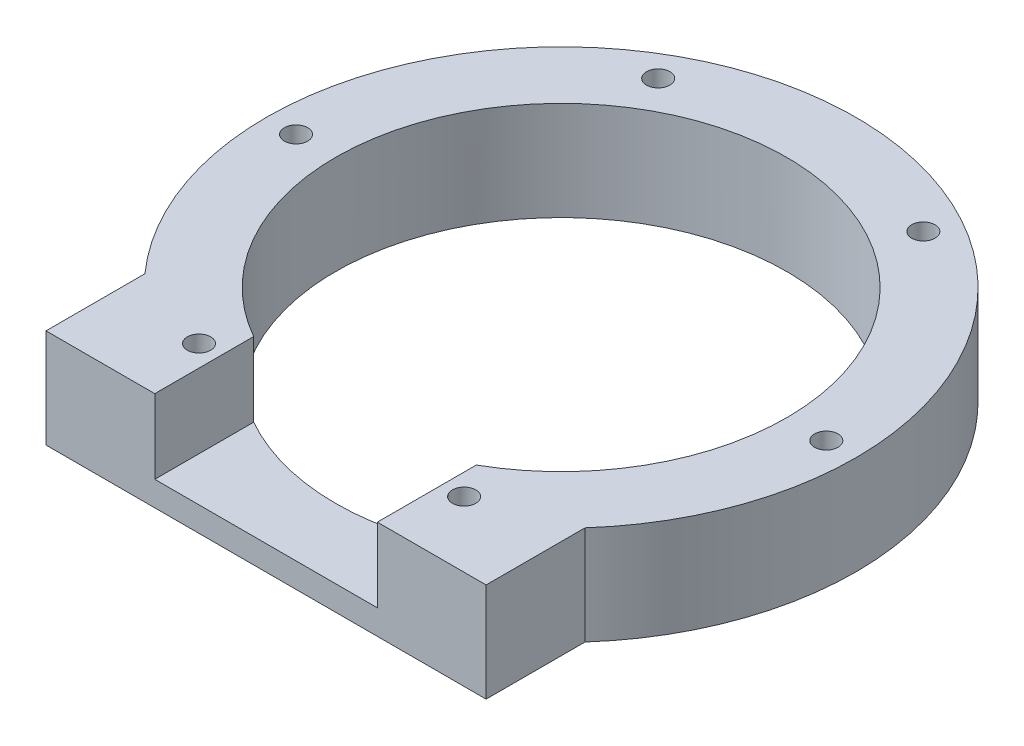
from build123d import *
from build123d.topology import SkipClean

# Parameters (mm, degrees)
BOSS_EXTRUDE1_DEPTH   = 12.7
SKETCH5_W             = 13.961436905
SKETCH5_H             = 12.7
BOSS_EXTRUDE3_DEPTH   = 12.7
F_3_0MM_DOWEL_HOLE1_D = 3
BOSS_EXTRUDE4_DEPTH   = 3.175


with BuildPart() as part:
    # Sketch1 → Boss-Extrude1 (new body)
    with BuildSketch(Plane(origin=(0, 0, 0), x_dir=(1, 0, 0), z_dir=(0, 1, 0))):
        with BuildLine():
            ThreePointArc((28.956, 0), (25.021578547, -14.572938722), (14.2875, -25.18565623))
            Line((14.2875, -25.18565623), (28.248936905, -25.18565623))
            ThreePointArc((28.248936905, -25.18565623), (35.365442045, -13.476098284), (37.846, 0))
            ThreePointArc((37.846, 0), (-13.476098284, 35.365442045), (-28.248936905, -25.18565623))
            Line((-28.248936905, -25.18565623), (-14.2875, -25.18565623))
            ThreePointArc((-14.2875, -25.18565623), (-14.572938722, 25.021578547), (28.956, 0))
        make_face()
    extrude(amount=BOSS_EXTRUDE1_DEPTH)

    # Sketch5 → Boss-Extrude3 (add)
    with BuildSketch(Plane.XY.offset(25.18565623)):
        with Locations((-21.268218453, 6.35)):
            Rectangle(SKETCH5_W, SKETCH5_H)
        with Locations((21.268218453, 6.35)):
            Rectangle(SKETCH5_W, SKETCH5_H)
    extrude(amount=BOSS_EXTRUDE3_DEPTH)

    # Ø3.0mm Dowel Hole1 (through all)
    with Locations(Plane(origin=(0, 0, 0), x_dir=(-1, 0, 0), z_dir=(0, -1, 0))):
        with Locations((-17.018, 29.476040643), (-34.036, 0), (17.018, 29.476040643), (34.036, 0), (17.018, -29.476040643), (-17.018, -29.476040643)):
            Hole(F_3_0MM_DOWEL_HOLE1_D / 2)

    # Sketch11 → Boss-Extrude4 (add)
    with SkipClean():  # the faces are left unmerged after this step: merging them gives an invalid solid
        with BuildSketch(Plane.XZ):
            with BuildLine():
                ThreePointArc((-14.2875, 25.18565623), (0, 28.956), (14.2875, 25.18565623))
                Line((14.2875, 25.18565623), (14.2875, 37.88565623))
                Line((14.2875, 37.88565623), (-14.2875, 37.88565623))
                Line((-14.2875, 37.88565623), (-14.2875, 25.18565623))
            make_face()
        extrude(amount=-BOSS_EXTRUDE4_DEPTH)


solid = part.part
